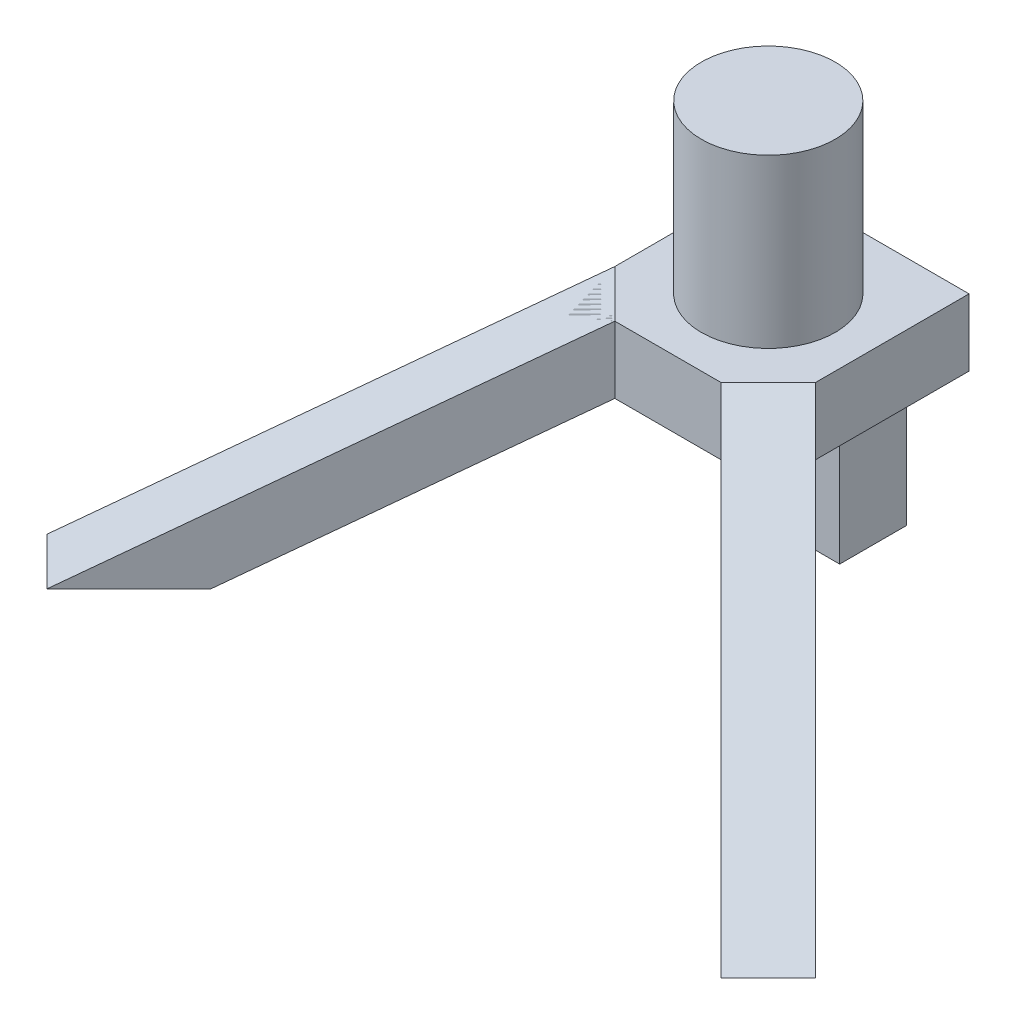
from build123d import *

# Parameters (mm, degrees)
SKETCH2_W           = 60
SKETCH2_H           = 60
SKETCH2_R           = 20
BOSS_EXTRUDE3_DEPTH = 20
BOSS_EXTRUDE5_START = 20
SKETCH2_4_R         = 20
BOSS_EXTRUDE5_DEPTH = 50
BOSS_EXTRUDE6_DEPTH = 10
CUT_EXTRUDE2_DEPTH  = 10
CUT_EXTRUDE3_DEPTH  = 10
SKETCH13_W          = 20
SKETCH13_H          = 20
BOSS_EXTRUDE8_DEPTH = 49.282032303


with BuildPart() as part:
    # Sketch2 → Boss-Extrude3 (new body)
    # profile 1 of 2: a face of its own
    with BuildSketch(Plane(origin=(0, 0, 0), x_dir=(1, 0, 0), z_dir=(0, 1, 0))):
        Rectangle(SKETCH2_W, SKETCH2_H)
        Circle(SKETCH2_R, mode=Mode.SUBTRACT)
    # profile 2 of 2: a face of its own
    with BuildSketch(Plane(origin=(0, 0, 0), x_dir=(1, 0, 0), z_dir=(0, 1, 0))):
        Circle(SKETCH2_R)
    extrude(amount=BOSS_EXTRUDE3_DEPTH)

    # Sketch2<4> → Boss-Extrude5 (add)
    with BuildSketch(Plane(origin=(0, 0, 0), x_dir=(1, 0, 0), z_dir=(0, 1, 0)).offset(BOSS_EXTRUDE5_START)):
        with Locations(Location((0, 0, 0), (0, 0, 270))):
            Circle(SKETCH2_4_R)
    extrude(amount=BOSS_EXTRUDE5_DEPTH)


with BuildPart() as body_2:
    # Sketch5 → Boss-Extrude6 (new, symmetric)
    with BuildSketch(Plane(origin=(0, 0, 0), x_dir=(0.7071067811865472, 0, -0.7071067811865478), z_dir=(0.7071067811865478, 0, 0.7071067811865472))):
        Polygon((-32.426406871, 20), (-152.426406871, -49.282032303), (-117.78539072, -49.282032303), (-32.426406871, 0), align=None)
    boss_extrude6 = extrude(amount=BOSS_EXTRUDE6_DEPTH, both=True)


with BuildPart() as part_1:
    add(part.part)

    # Mirror3: Boss-Extrude6 across plane
    add(boss_extrude6.mirror(Plane(origin=(0, 0, 0), x_dir=(0, 0, 1), z_dir=(1, 0, 0))))

    # Sketch11 → Cut-Extrude2 (cut)
    with BuildSketch(Plane(origin=(11.855957404, 29.041046052, 11.855957404), x_dir=(0.9259415151999266, -0.2703581015304675, -0.2637021186227093), z_dir=(0.3535533905932722, 0.8660254037844398, 0.3535533905932724))):
        Polygon((1.365229379, -20.617909778), (18.189330993, -9.803585716), (18.189330993, -28.29757562), align=None)
    extrude(amount=CUT_EXTRUDE2_DEPTH, mode=Mode.SUBTRACT)

    # Sketch12 → Cut-Extrude3 (cut)
    with BuildSketch(Plane(origin=(-11.855957404, 29.041046052, 11.855957404), x_dir=(0.9259415151999266, 0.2703581015304675, 0.2637021186227093), z_dir=(-0.3535533905932722, 0.8660254037844398, 0.3535533905932724))):
        Polygon((-93.113165887, -126.364380861), (-76.289064273, -137.178704922), (-1.365229379, -20.617909778), (-18.189330993, -9.803585716), align=None)
    extrude(amount=CUT_EXTRUDE3_DEPTH, mode=Mode.SUBTRACT)

    # Sketch13 → Boss-Extrude8 (add)
    with BuildSketch(Plane.XZ):
        with Locations((1.334047935, -20)):
            Rectangle(SKETCH13_W, SKETCH13_H)
    extrude(amount=BOSS_EXTRUDE8_DEPTH)


solid = Compound([body_2.part, part_1.part])
